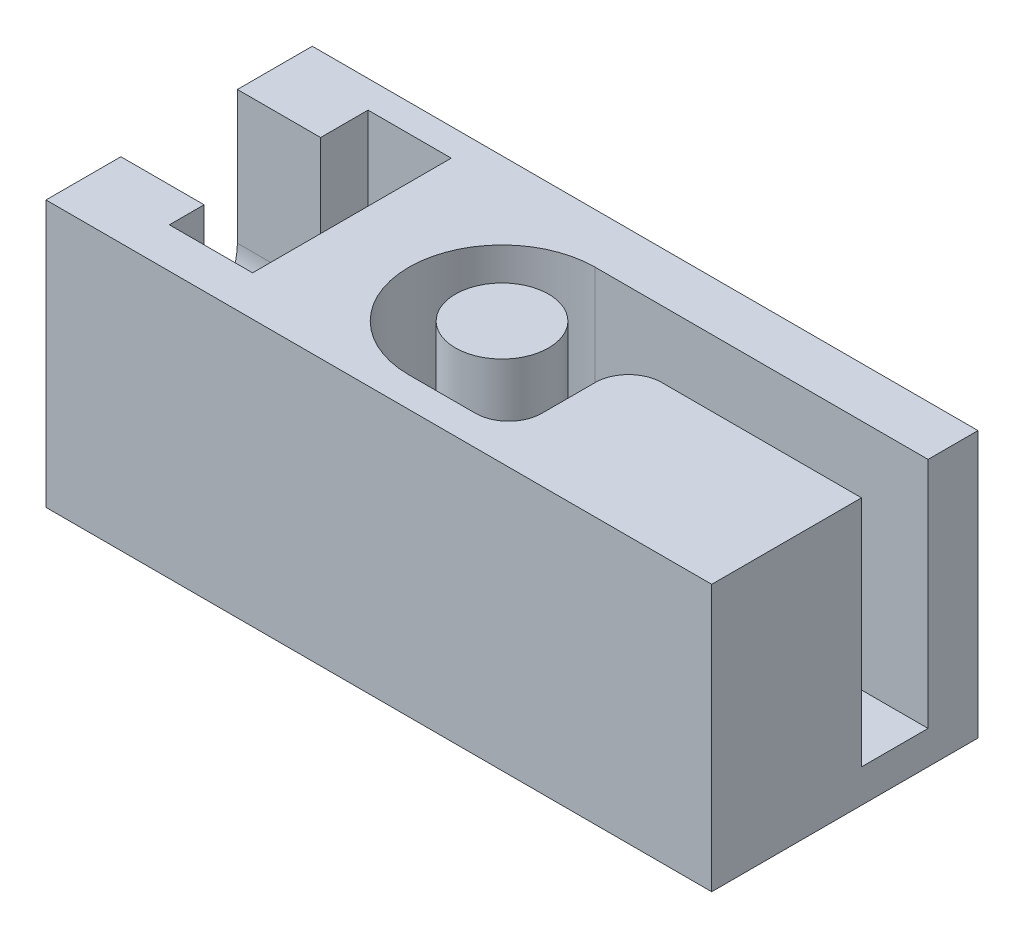
from build123d import *

# Parameters (mm, degrees)
SKETCH1_W           = 20
SKETCH1_H           = 8
BOSS_EXTRUDE1_DEPTH = 8
SKETCH2_R           = 1.4
CUT_EXTRUDE1_DEPTH  = 7
CUT_EXTRUDE2_DEPTH  = 5
CUT_EXTRUDE3_DEPTH  = 2.5


with BuildPart() as part:
    # Sketch1 → Boss-Extrude1 (new body)
    with BuildSketch(Plane(origin=(0, 0, 0), x_dir=(1, 0, 0), z_dir=(0, 1, 0))):
        with Locations((10, 4)):
            Rectangle(SKETCH1_W, SKETCH1_H)
    extrude(amount=BOSS_EXTRUDE1_DEPTH)

    # Sketch2 → Cut-Extrude1 (cut)
    with BuildSketch(Plane(origin=(0, 8, 0), x_dir=(1, 0, 0), z_dir=(0, 1, 0))):
        with BuildLine():
            Line((20, 6.5), (10, 6.5))
            ThreePointArc((10, 6.5), (7.2, 3.7), (10, 0.9))
            Line((10, 0.9), (12, 0.9))
            ThreePointArc((12, 0.9), (12.707106781, 1.192893219), (13, 1.9))
            Line((13, 1.9), (13, 3.5))
            ThreePointArc((13, 3.5), (13.292893219, 4.207106781), (14, 4.5))
            Line((14, 4.5), (20, 4.5))
            Line((20, 4.5), (20, 6.5))
        make_face()
        with Locations(Location((10, 3.7, 0), (0, 0, 270))):
            Circle(SKETCH2_R, mode=Mode.SUBTRACT)
    extrude(amount=-CUT_EXTRUDE1_DEPTH, mode=Mode.SUBTRACT)

    # Sketch4 → Cut-Extrude2 (cut)
    with BuildSketch(Plane.ZY):
        with BuildLine():
            Line((-5.75, 4), (-5.75, 8))
            Line((-5.75, 8), (-2.25, 8))
            Line((-2.25, 8), (-2.25, 4))
            ThreePointArc((-2.25, 4), (-4, 2.25), (-5.75, 4))
        make_face()
    extrude(amount=-CUT_EXTRUDE2_DEPTH, mode=Mode.SUBTRACT)

    # Sketch5 → Cut-Extrude3 (cut)
    with BuildSketch(Plane.ZY.offset(-5)):
        Polygon((-7.175426481, 3.5), (-7.175426481, 14.06619177), (-1.206769201, 14.06619177), (-1.206769201, 3.638089636), (-1.953153528, 1.572294735), (-5.079031196, 1.013526325), align=None)
    extrude(amount=CUT_EXTRUDE3_DEPTH, mode=Mode.SUBTRACT)


solid = part.part
